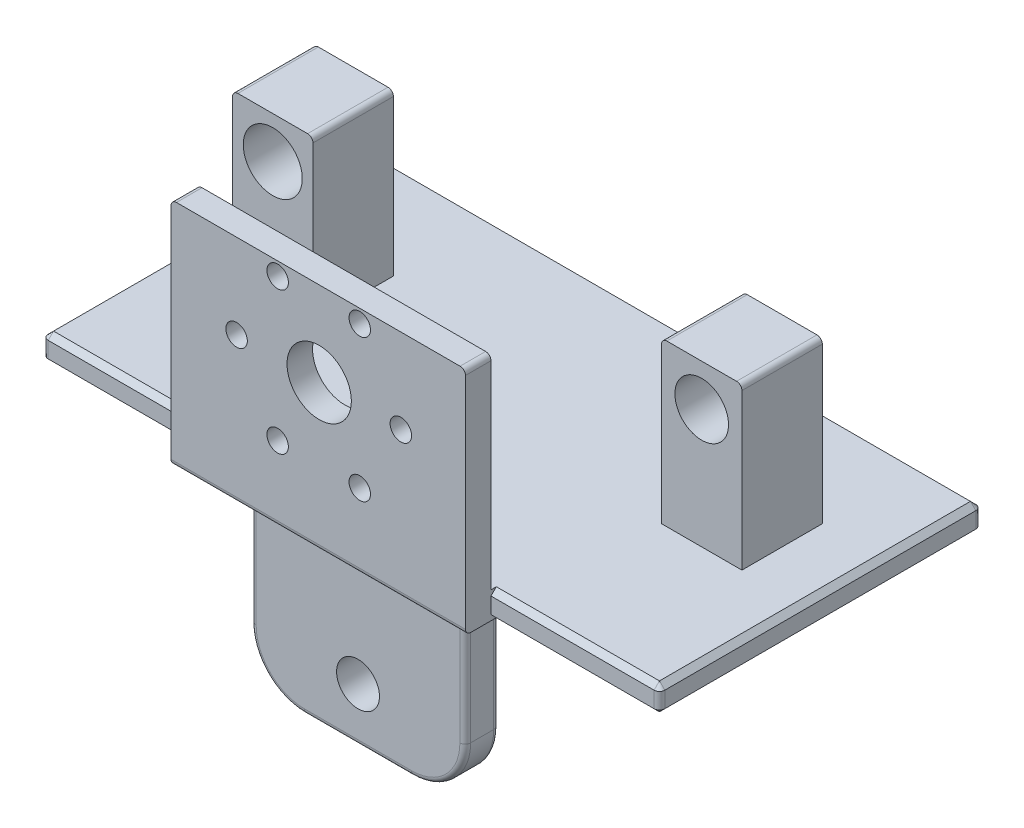
from build123d import *

# Parameters (mm, degrees)
CROQUIS1_W                = 15
CROQUIS1_H                = 15
SALIENTE_EXTRUIR1_DEPTH   = 30
SALIENTE_EXTRUIR1_2_DEPTH = 30
CROQUIS2_R                = 5.5
CORTAR_EXTRUIR1_DEPTH     = 30
CROQUIS3_R                = 5
CORTAR_EXTRUIR2_DEPTH     = 30
CROQUIS5_W                = 115
CROQUIS5_H                = 60
SALIENTE_EXTRUIR3_DEPTH   = 5
CROQUIS6_W                = 54.898151636
CROQUIS6_H                = 43
SALIENTE_EXTRUIR4_DEPTH   = 4.7625
CROQUIS7_R                = 2
CORTAR_EXTRUIR3_DEPTH     = 4.7625
CROQUIS8_R                = 6
CORTAR_EXTRUIR4_DEPTH     = 10
CROQUIS9_W                = 40
CROQUIS9_H                = 6.3
SALIENTE_EXTRUIR5_DEPTH   = 35
REDONDEO1_R               = 10
CORTAR_EXTRUIR5_REACH     = 95.087
CROQUIS10_R               = 4
REDONDEO3_R               = 1
REDONDEO4_R               = 1
REDONDEO5_R               = 1
REDONDEO6_R               = 1
REDONDEO8_R               = 1
CHAFL_N1_SIZE             = 1


with BuildPart() as part:
    # Croquis1 → Saliente-Extruir1 (new body)
    with BuildSketch(Plane(origin=(0, 0, 0), x_dir=(1, 0, 0), z_dir=(0, 1, 0))):
        with Locations((-37.5, 20.000000005)):
            Rectangle(CROQUIS1_W, CROQUIS1_H)
    extrude(amount=SALIENTE_EXTRUIR1_DEPTH)

    # Croquis2 → Cortar-Extruir1 (cut)
    with BuildSketch(Plane(origin=(0, 0, -27.500000005), x_dir=(-1, 0, 0), z_dir=(0, 0, -1))):
        with Locations((37.5, 22.231754591)):
            Circle(CROQUIS2_R)
    extrude(amount=-CORTAR_EXTRUIR1_DEPTH, mode=Mode.SUBTRACT)



with BuildPart() as body_2:
    # Croquis1 → Saliente-Extruir1 2 (new body)
    with BuildSketch(Plane(origin=(0, 0, 0), x_dir=(1, 0, 0), z_dir=(0, 1, 0))):
        with Locations((42.5, 20.000000005)):
            Rectangle(CROQUIS1_W, CROQUIS1_H)
    extrude(amount=SALIENTE_EXTRUIR1_2_DEPTH)

    # Croquis3 → Cortar-Extruir2 (cut)
    with BuildSketch(Plane(origin=(0, 0, -27.500000005), x_dir=(-1, 0, 0), z_dir=(0, 0, -1))):
        with Locations((-42.5, 22.231754591)):
            Circle(CROQUIS3_R)
    extrude(amount=-CORTAR_EXTRUIR2_DEPTH, mode=Mode.SUBTRACT)


with BuildPart() as part_1:
    add(part.part)

    add(body_2.part)  # Saliente-Extruir3 merges body 2
    # Croquis5 → Saliente-Extruir3 (add)
    with BuildSketch(Plane(origin=(0, 0, 0), x_dir=(1, 0, 0), z_dir=(0, 1, 0))):
        with Locations((3.699250586, 15.919051757)):
            Rectangle(CROQUIS5_W, CROQUIS5_H)
    extrude(amount=-SALIENTE_EXTRUIR3_DEPTH)

    # Croquis6 → Saliente-Extruir4 (add)
    with BuildSketch(Plane.XY.offset(14.080948243)):
        with Locations((2.330070819, 16.5)):
            Rectangle(CROQUIS6_W, CROQUIS6_H)
    extrude(amount=SALIENTE_EXTRUIR4_DEPTH)

    # Croquis7 → Cortar-Extruir3 (cut)
    with BuildSketch(Plane.XY.offset(18.843448243)):
        with Locations((17.730070819, 22.23)):
            Circle(CROQUIS7_R)
        with Locations((10.071882042, 8.965627944)):
            Circle(CROQUIS7_R)
        with Locations((-5.244495512, 8.965627944)):
            Circle(CROQUIS7_R)
        with Locations((-12.902684289, 22.23)):
            Circle(CROQUIS7_R)
        with Locations((-5.244495512, 35.494372056)):
            Circle(CROQUIS7_R)
        with Locations((10.071882042, 35.494372056)):
            Circle(CROQUIS7_R)
    extrude(amount=-CORTAR_EXTRUIR3_DEPTH, mode=Mode.SUBTRACT)

    # Croquis8 → Cortar-Extruir4 (cut)
    with BuildSketch(Plane.XY.offset(18.843448243)):
        with Locations((2.5, 22.231754591)):
            Circle(CROQUIS8_R)
    extrude(amount=-CORTAR_EXTRUIR4_DEPTH, mode=Mode.SUBTRACT)

    # Croquis9 → Saliente-Extruir5 (add)
    with BuildSketch(Plane(origin=(0, -5, 0), x_dir=(-1, 0, 0), z_dir=(0, -1, 0))):
        with Locations((-2.600505063, 33.750505063)):
            Rectangle(CROQUIS9_W, CROQUIS9_H)
        with Locations((-2.600505063, -8.549494937)):
            Rectangle(CROQUIS9_W, CROQUIS9_H)
    extrude(amount=SALIENTE_EXTRUIR5_DEPTH)

    # Redondeo1
    redondeo1_edges = [part_1.edges().sort_by_distance(p)[0] for p in [
        (22.600505063, -40, 8.549494937),
        (-17.399494937, -40, 8.549494937),
        (-17.399494937, -40, -33.750505063),
        (22.600505063, -40, -33.750505063),
    ]]
    fillet(redondeo1_edges, radius=REDONDEO1_R)

    # Cortar-Extruir5: up to this face of the body (flat: up to its plane)
    cortar_extruir5_end = Plane(part_1.part.faces().sort_by_distance((2.600505063, -22.017171968, -36.900505063))[0])
    # Croquis10 → Cortar-Extruir5 (cut, up to the picked face)
    with BuildSketch(Plane.XY.offset(11.699494937), mode=Mode.PRIVATE) as cortar_extruir5_sk1:
        with Locations((2.600505063, -30)):
            Circle(CROQUIS10_R)
    cortar_extruir5_tool1 = split(extrude(cortar_extruir5_sk1.sketch, amount=-CORTAR_EXTRUIR5_REACH, mode=Mode.PRIVATE), bisect_by=cortar_extruir5_end, keep=Keep.BOTH, mode=Mode.PRIVATE)
    add(cortar_extruir5_tool1.solids().sort_by(Axis((2.600505, -30, 11.699495), (0, 0, -1)))[0], mode=Mode.SUBTRACT)

    # Redondeo3
    redondeo3_edges = [part_1.edges().sort_by_distance(p)[0] for p in [
        (2.600505063, -40, -36.900505063),
        (2.600505063, -40, -30.600505063),
        (-17.399494937, -17.5, -30.600505063),
        (22.600505063, -17.5, -30.600505063),
        (-14.470562748, -37.071067812, -30.600505063),
        (19.671572875, -37.071067812, -30.600505063),
        (22.600505063, -17.5, -36.900505063),
        (-17.399494937, -17.5, -36.900505063),
        (-14.470562748, -37.071067812, -36.900505063),
        (19.671572875, -37.071067812, -36.900505063),
        (2.600505063, -40, 11.699494937),
        (2.600505063, -40, 5.399494937),
        (-17.399494937, -17.5, 11.699494937),
        (22.600505063, -17.5, 11.699494937),
        (-14.470562748, -37.071067812, 11.699494937),
        (19.671572875, -37.071067812, 11.699494937),
        (22.600505063, -17.5, 5.399494937),
        (-17.399494937, -17.5, 5.399494937),
        (-14.470562748, -37.071067812, 5.399494937),
        (19.671572875, -37.071067812, 5.399494937),
    ]]
    fillet(redondeo3_edges, radius=REDONDEO3_R)

    # Redondeo4
    redondeo4_edges = [part_1.edges().sort_by_distance(p)[0] for p in [
        (61.199250586, -2.5, 14.080948243),
        (-53.800749414, -2.5, 14.080948243),
        (-53.800749414, -2.5, -45.919051757),
        (61.199250586, -2.5, -45.919051757),
    ]]
    fillet(redondeo4_edges, radius=REDONDEO4_R)

    # Redondeo5
    redondeo5_edges = [part_1.edges().sort_by_distance(p)[0] for p in [
        (-30, 30, -20.000000005),
        (35, 30, -20.000000005),
        (50, 30, -20.000000005),
        (-45, 30, -20.000000005),
    ]]
    fillet(redondeo5_edges, radius=REDONDEO5_R)

    # Redondeo6
    redondeo6_edges = [part_1.edges().sort_by_distance(p)[0] for p in [
        (-25.119004999, 38, 16.462198243),
        (29.779146637, 38, 16.462198243),
    ]]
    fillet(redondeo6_edges, radius=REDONDEO6_R)

    # Redondeo8
    redondeo8_edges = [part_1.edges().sort_by_distance(p)[0] for p in [
        (2.330070819, -5, 18.843448243),
    ]]
    fillet(redondeo8_edges, radius=REDONDEO8_R)

    # Chaflán1
    chafl_n1_edges = [part_1.edges().sort_by_distance(p)[0] for p in [
        (-38.959877207, 0, 14.080948243),
        (61.199250586, 0, -15.919051757),
        (3.699250586, 0, -45.919051757),
        (-53.800749414, 0, -15.919051757),
        (60.906357367, 0, -45.626158538),
        (-53.507856195, 0, -45.626158538),
        (-53.507856195, 0, 13.788055024),
        (60.906357367, 0, 13.788055024),
        (61.199250586, -5, -15.919051757),
        (-38.959877207, -5, 14.080948243),
        (-53.800749414, -5, -15.919051757),
        (3.699250586, -5, -45.919051757),
        (60.906357367, -5, -45.626158538),
        (-53.507856195, -5, -45.626158538),
        (-53.507856195, -5, 13.788055024),
        (60.906357367, -5, 13.788055024),
        (44.989198611, 0, 14.080948243),
        (44.989198611, -5, 14.080948243),
    ]]
    chamfer(chafl_n1_edges, length=CHAFL_N1_SIZE)


solid = part_1.part
